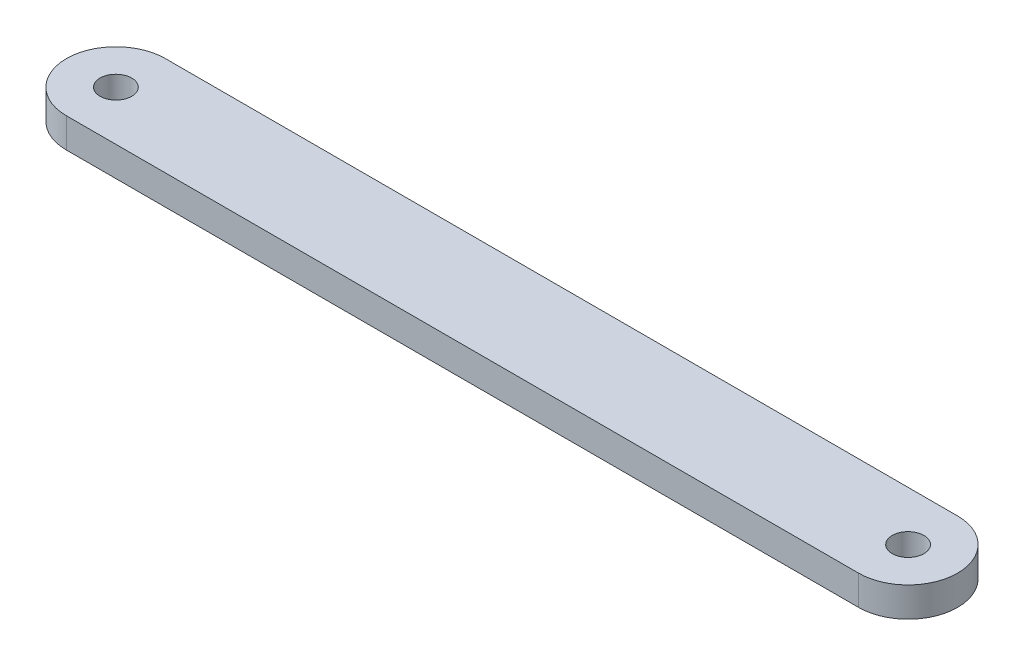
from build123d import *

# Parameters (mm, degrees)
SKETCH_1_R      = 1.6
EXTRUDE_1_DEPTH = 3


with BuildPart() as part:
    # ｽｹｯﾁ1 → ﾎﾞｽ - 押し出し1 (new body)
    with BuildSketch(Plane(origin=(0, 0, 0), x_dir=(1, 0, 0), z_dir=(0, 1, 0))):
        with BuildLine():
            Line((0, -5), (80, -5))
            ThreePointArc((80, -5), (85, 0), (80, 5))
            Line((80, 5), (0, 5))
            ThreePointArc((0, 5), (-5, 0), (0, -5))
        make_face()
        with Locations(Location((0, 0, 0), (0, 0, 270))):
            Circle(SKETCH_1_R, mode=Mode.SUBTRACT)
        with Locations(Location((80, 0, 0), (0, 0, 270))):
            Circle(SKETCH_1_R, mode=Mode.SUBTRACT)
    extrude(amount=EXTRUDE_1_DEPTH)


solid = part.part
